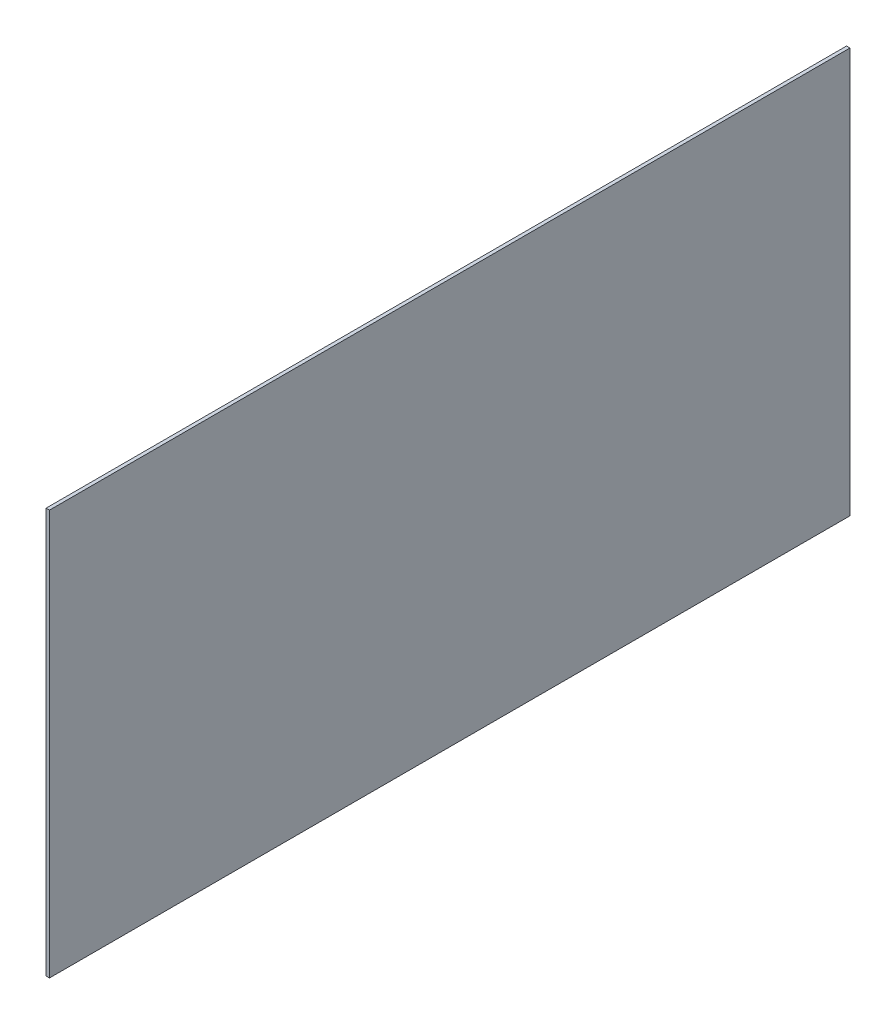
from build123d import *

# Parameters (mm, degrees)
SKETCH2_W           = 350.475992289
SKETCH2_H           = 177.4
BOSS_EXTRUDE1_DEPTH = 1.5


with BuildPart() as part:
    # Sketch2 → Boss-Extrude1 (new body)
    with BuildSketch(Plane(origin=(0, 0, 0), x_dir=(0, 0, -1), z_dir=(1, 0, 0))):
        with Locations((-296.936579209, -193.125999334)):
            Rectangle(SKETCH2_W, SKETCH2_H)
    extrude(amount=BOSS_EXTRUDE1_DEPTH)


solid = part.part
